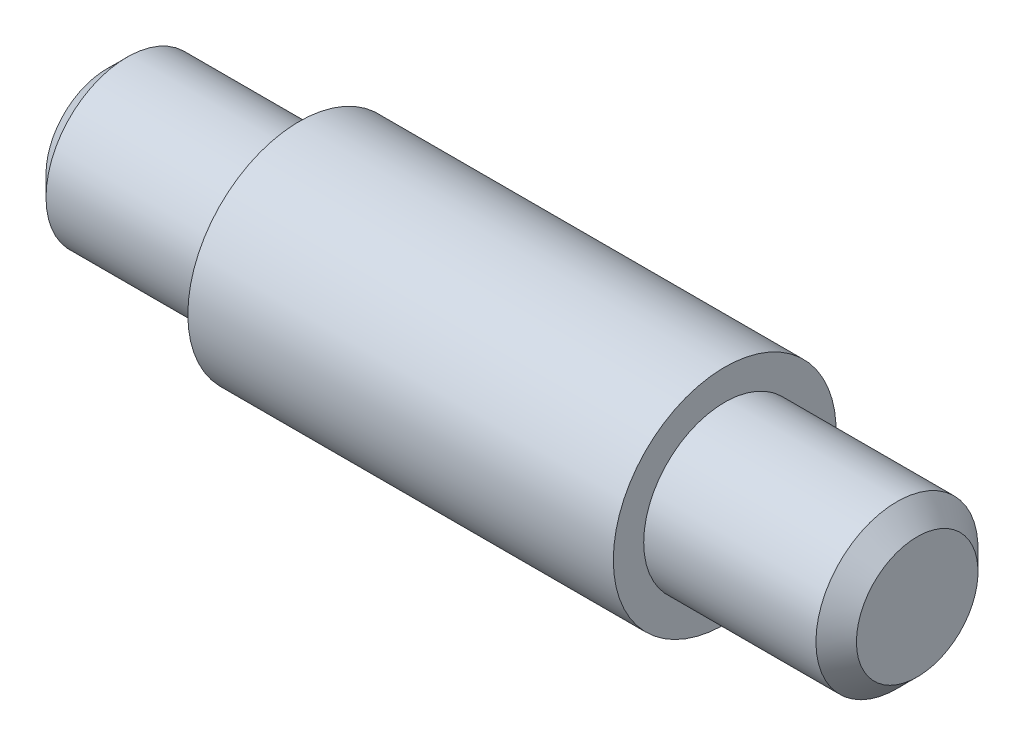
from build123d import *

# Parameters (mm, degrees)
CHAMFER_1_SIZE = 2


with BuildPart() as part:
    # 草圖1 → 旋轉1 (revolve)
    with BuildSketch(Plane.XY, mode=Mode.PRIVATE) as revolve_1_sk:
        Polygon((0, 0), (0, 11), (21, 11), (21, 8), (40, 8), (40, 0), align=None)
    revolve(revolve_1_sk.sketch.rotate(Axis((0, 0, 0), (1, 0, 0)), 90), axis=Axis((0, 0, 0), (1, 0, 0)))

    # 導角1
    chamfer_1_edges = [part.edges().sort_by_distance(p)[0] for p in [
        (40, 0, -8),
    ]]
    chamfer(chamfer_1_edges, length=CHAMFER_1_SIZE)

    # 鏡射1: part across plane


with BuildPart() as part_1:
    add(part.part)
    add(part.part.mirror(Plane(origin=(0, 0, 0), x_dir=(0, 0, 1), z_dir=(1, 0, 0))))


solid = part_1.part
